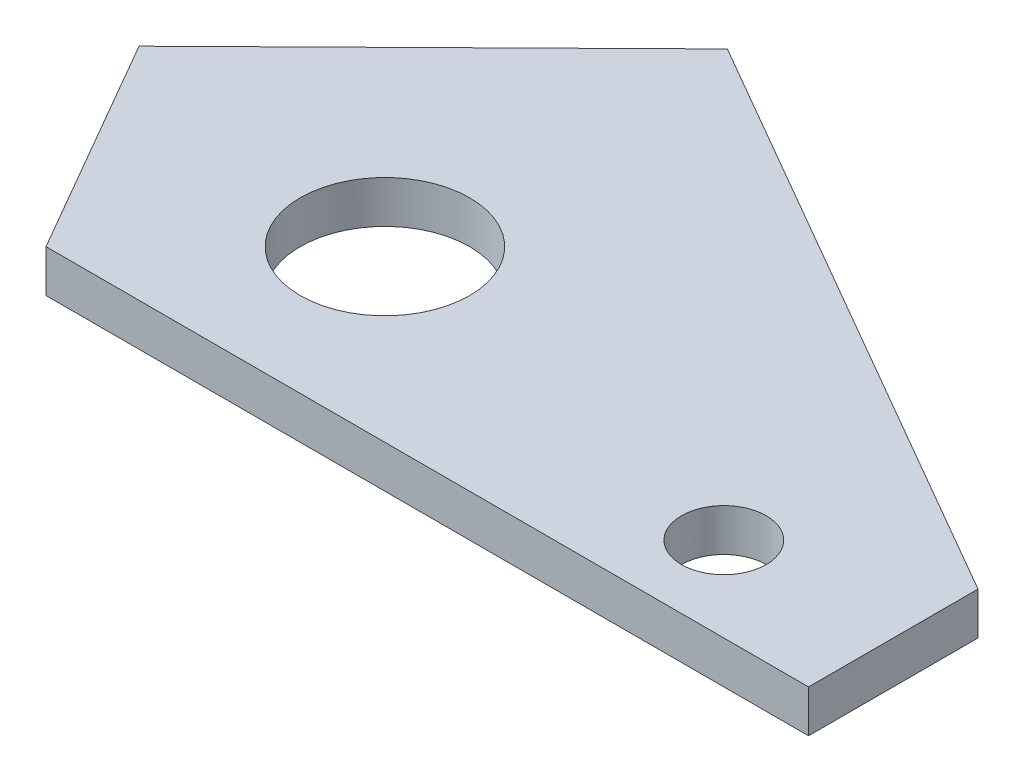
from build123d import *

# Parameters (mm, degrees)
SKETCH1_W           = 114.3
SKETCH1_H           = 25.4
BOSS_EXTRUDE1_DEPTH = 6.35
CUT_EXTRUDE1_REACH  = 155.979
SKETCH2_R           = 12.7
SKETCH2_R_2         = 6.35


with BuildPart() as part:
    # Sketch1 → Boss-Extrude1 (new body)
    with BuildSketch(Plane(origin=(0, 0, 0), x_dir=(1, 0, 0), z_dir=(0, 1, 0))):
        with Locations((-57.15, 12.7)):
            Rectangle(SKETCH1_W, SKETCH1_H)
        Polygon((-88.9, 76.726438931), (0, 25.4), (-114.3, 25.4), (-114.3, 0), (-133.35, 32.995567884), align=None)
    extrude(amount=BOSS_EXTRUDE1_DEPTH)

    # Sketch2 → Cut-Extrude1 (cut, up to next)
    with BuildSketch(Plane.XZ, mode=Mode.PRIVATE) as cut_extrude1_sk1:
        with Locations(Location((-88.9, -25.4, 0), (0, 0, 270))):
            Circle(SKETCH2_R)
    cut_extrude1_tool1 = extrude(cut_extrude1_sk1.sketch, amount=-CUT_EXTRUDE1_REACH, mode=Mode.PRIVATE) & part.part
    # Sketch2 → Cut-Extrude1 (cut, up to next)
    with BuildSketch(Plane.XZ, mode=Mode.PRIVATE) as cut_extrude1_sk2:
        with Locations(Location((-25.4, -12.7, 0), (0, 0, 270))):
            Circle(SKETCH2_R_2)
    cut_extrude1_tool2 = extrude(cut_extrude1_sk2.sketch, amount=-CUT_EXTRUDE1_REACH, mode=Mode.PRIVATE) & part.part
    add(cut_extrude1_tool1.solids().sort_by_distance((-88.9, 0, -25.4))[0], mode=Mode.SUBTRACT)
    add(cut_extrude1_tool2.solids().sort_by_distance((-25.4, 0, -12.7))[0], mode=Mode.SUBTRACT)


solid = part.part
